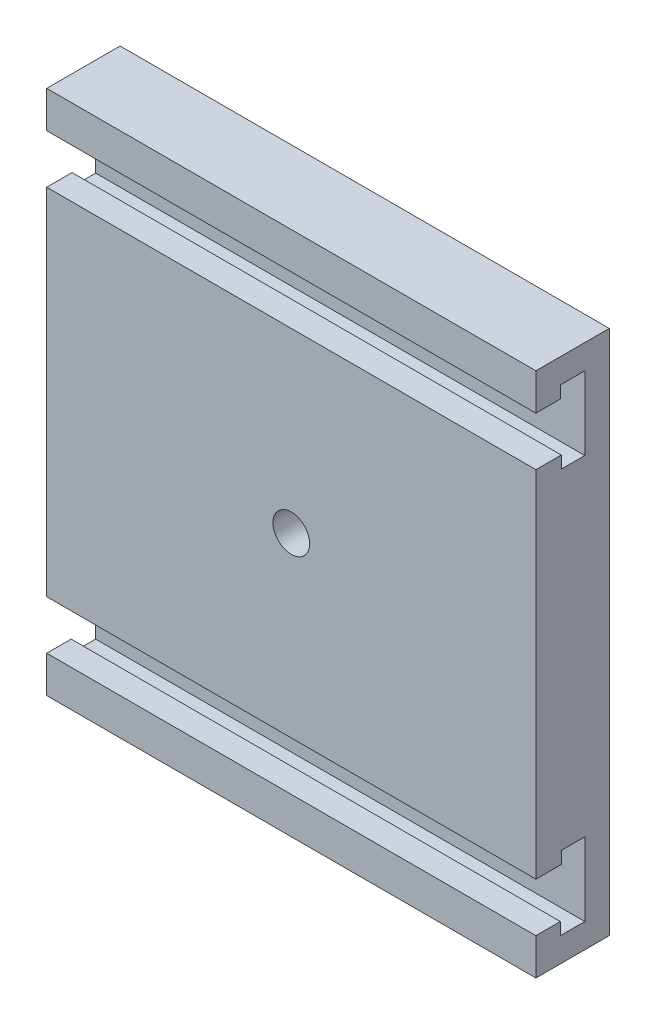
from build123d import *

# Parameters (mm, degrees)
SKETCH_1_W          = 40
SKETCH_1_H          = 43
SKETCH_1_R          = 1.5
EXTRUDE_1_DEPTH     = 6
CUT_EXTRUDE_1_DEPTH = 46.806658905


with BuildPart() as part:
    # 草图1 → 凸台-拉伸1 (new body)
    with BuildSketch(Plane.XY):
        Rectangle(SKETCH_1_W, SKETCH_1_H)
        Circle(SKETCH_1_R, mode=Mode.SUBTRACT)
    extrude(amount=EXTRUDE_1_DEPTH)

    # 草图2 → 切除-拉伸1 (cut, through all)
    with BuildSketch(Plane(origin=(20, 0, 0), x_dir=(0, 0, -1), z_dir=(1, 0, 0))):
        Polygon((-6, 18.5), (-4, 18.5), (-4, 19.5), (-2, 19.5), (-2, 13.5), (-3.925973419, 13.5), (-3.925973419, 14.5), (-6, 14.5), align=None)
        Polygon((-6, -18.5), (-6, -14.5), (-3.925973419, -14.5), (-3.925973419, -13.5), (-2, -13.5), (-2, -19.5), (-4, -19.5), (-4, -18.5), align=None)
    extrude(amount=-CUT_EXTRUDE_1_DEPTH, mode=Mode.SUBTRACT)


solid = part.part
